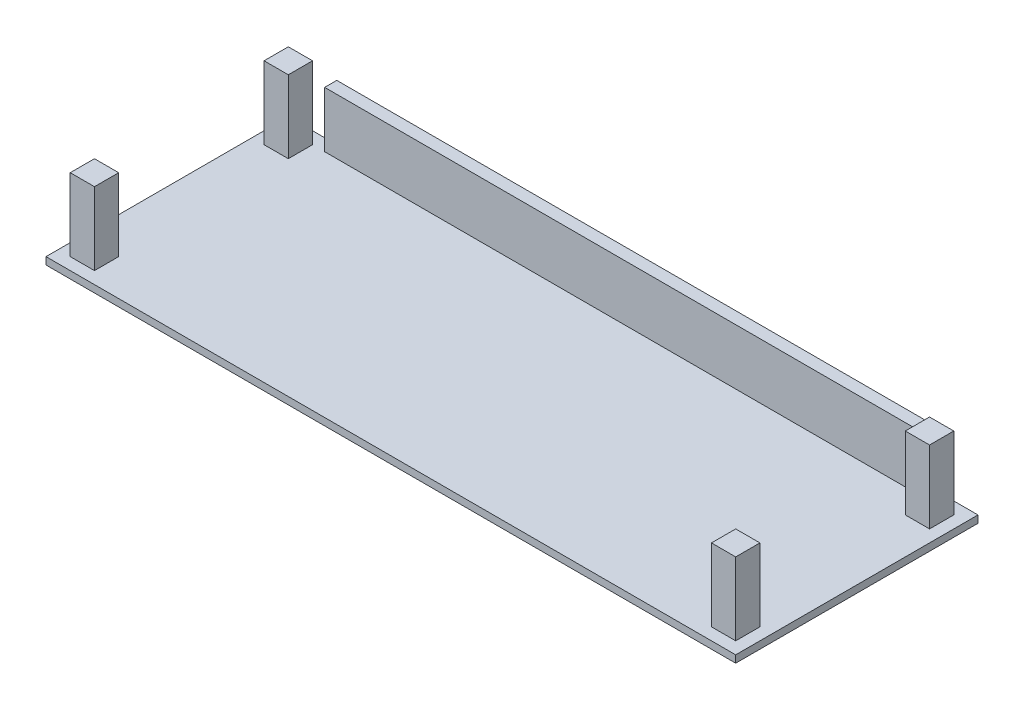
from build123d import *

# Parameters (mm, degrees)
SKETCH_2_W        = 10
SKETCH_2_H        = 10
EXTRUDE_1_DEPTH   = 30
EXTRUDE_1_2_DEPTH = 30
EXTRUDE_1_3_DEPTH = 30
EXTRUDE_1_4_DEPTH = 30
SKETCH_3_W        = 284.641016152
SKETCH_3_H        = 100
EXTRUDE_2_DEPTH   = 3
SKETCH_4_W        = 244.638026471
SKETCH_4_H        = 5
EXTRUDE_3_DEPTH   = 23


with BuildPart() as part:
    # 草图2 → 凸台-拉伸1 (new body)
    with BuildSketch(Plane(origin=(0, 0, 0), x_dir=(1, 0, 0), z_dir=(0, 1, 0))):
        with Locations((-132.320508076, 40)):
            Rectangle(SKETCH_2_W, SKETCH_2_H)
    extrude(amount=EXTRUDE_1_DEPTH)



with BuildPart() as body_2:
    # 草图2 → Extrude 1 2 (new body)
    with BuildSketch(Plane(origin=(0, 0, 0), x_dir=(1, 0, 0), z_dir=(0, 1, 0))):
        with Locations((-132.320508076, -40)):
            Rectangle(SKETCH_2_W, SKETCH_2_H)
    extrude(amount=EXTRUDE_1_2_DEPTH)


with BuildPart() as body_3:
    # 草图2 → Extrude 1 3 (new body)
    with BuildSketch(Plane(origin=(0, 0, 0), x_dir=(1, 0, 0), z_dir=(0, 1, 0))):
        with Locations((132.320508076, -40)):
            Rectangle(SKETCH_2_W, SKETCH_2_H)
    extrude(amount=EXTRUDE_1_3_DEPTH)


with BuildPart() as body_4:
    # 草图2 → Extrude 1 4 (new body)
    with BuildSketch(Plane(origin=(0, 0, 0), x_dir=(1, 0, 0), z_dir=(0, 1, 0))):
        with Locations((132.320508076, 40)):
            Rectangle(SKETCH_2_W, SKETCH_2_H)
    extrude(amount=EXTRUDE_1_4_DEPTH)


with BuildPart() as part_1:
    add(part.part)

    add(body_2.part)  # 凸台-拉伸2 merges body 2

    add(body_3.part)  # 凸台-拉伸2 merges body 3

    add(body_4.part)  # 凸台-拉伸2 merges body 4
    # 草图3 → 凸台-拉伸2 (add)
    with BuildSketch(Plane(origin=(0, 0, 0), x_dir=(1, 0, 0), z_dir=(0, 1, 0))):
        Rectangle(SKETCH_3_W, SKETCH_3_H)
    extrude(amount=-EXTRUDE_2_DEPTH)

    # 草图4 → 凸台-拉伸3 (add)
    with BuildSketch(Plane(origin=(0, 0, 0), x_dir=(1, 0, 0), z_dir=(0, 1, 0))):
        with Locations((-0.001494841, 47.5)):
            Rectangle(SKETCH_4_W, SKETCH_4_H)
    extrude(amount=EXTRUDE_3_DEPTH)


solid = part_1.part
